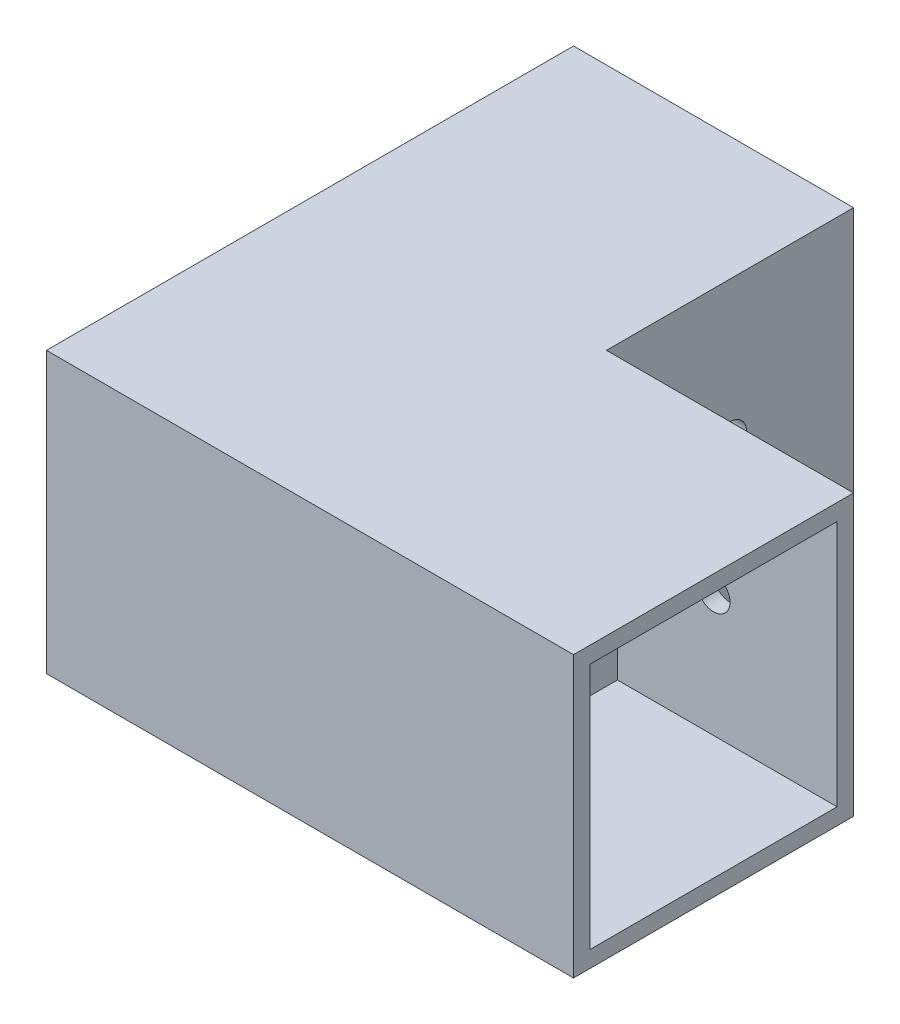
from build123d import *

# Parameters (mm, degrees)
BOSS_EXTRUDE1_DEPTH = 51
SKETCH2_W           = 45
SKETCH2_H           = 45
CUT_EXTRUDE1_DEPTH  = 40
SKETCH3_W           = 45
SKETCH3_H           = 45
CUT_EXTRUDE2_DEPTH  = 40
CUT_EXTRUDE3_REACH  = 119.69
SKETCH4_R           = 3
CUT_EXTRUDE4_REACH  = 119.69
SKETCH5_R           = 3


with BuildPart() as part:
    # Sketch1 → Boss-Extrude1 (new body)
    with BuildSketch(Plane(origin=(0, 0, 0), x_dir=(1, 0, 0), z_dir=(0, 1, 0))):
        Polygon((-3, -3), (-3, 93), (48, 93), (48, 48), (93, 48), (93, -3), align=None)
    extrude(amount=BOSS_EXTRUDE1_DEPTH)

    # Sketch2 → Cut-Extrude1 (cut)
    with BuildSketch(Plane(origin=(93, 0, 0), x_dir=(0, 0, -1), z_dir=(1, 0, 0))):
        with Locations((22.5, 25.5)):
            Rectangle(SKETCH2_W, SKETCH2_H)
    extrude(amount=-CUT_EXTRUDE1_DEPTH, mode=Mode.SUBTRACT)

    # Sketch3 → Cut-Extrude2 (cut)
    with BuildSketch(Plane(origin=(0, 0, -93), x_dir=(-1, 0, 0), z_dir=(0, 0, -1))):
        with Locations((-22.5, 25.5)):
            Rectangle(SKETCH3_W, SKETCH3_H)
    extrude(amount=-CUT_EXTRUDE2_DEPTH, mode=Mode.SUBTRACT)

    # Sketch4 → Cut-Extrude3 (cut, up to next)
    with BuildSketch(Plane(origin=(0, 0, -48), x_dir=(-1, 0, 0), z_dir=(0, 0, -1)), mode=Mode.PRIVATE) as cut_extrude3_sk1:
        with Locations((-70.5, 25.5)):
            Circle(SKETCH4_R)
    cut_extrude3_tool1 = extrude(cut_extrude3_sk1.sketch, amount=-CUT_EXTRUDE3_REACH, mode=Mode.PRIVATE) & part.part
    add(cut_extrude3_tool1.solids().sort_by_distance((70.5, 25.5, -48))[0], mode=Mode.SUBTRACT)

    # Sketch5 → Cut-Extrude4 (cut, up to next)
    with BuildSketch(Plane(origin=(48, 0, 0), x_dir=(0, 0, -1), z_dir=(1, 0, 0)), mode=Mode.PRIVATE) as cut_extrude4_sk1:
        with Locations((70.5, 25.5)):
            Circle(SKETCH5_R)
    cut_extrude4_tool1 = extrude(cut_extrude4_sk1.sketch, amount=-CUT_EXTRUDE4_REACH, mode=Mode.PRIVATE) & part.part
    add(cut_extrude4_tool1.solids().sort_by_distance((48, 25.5, -70.5))[0], mode=Mode.SUBTRACT)


solid = part.part
